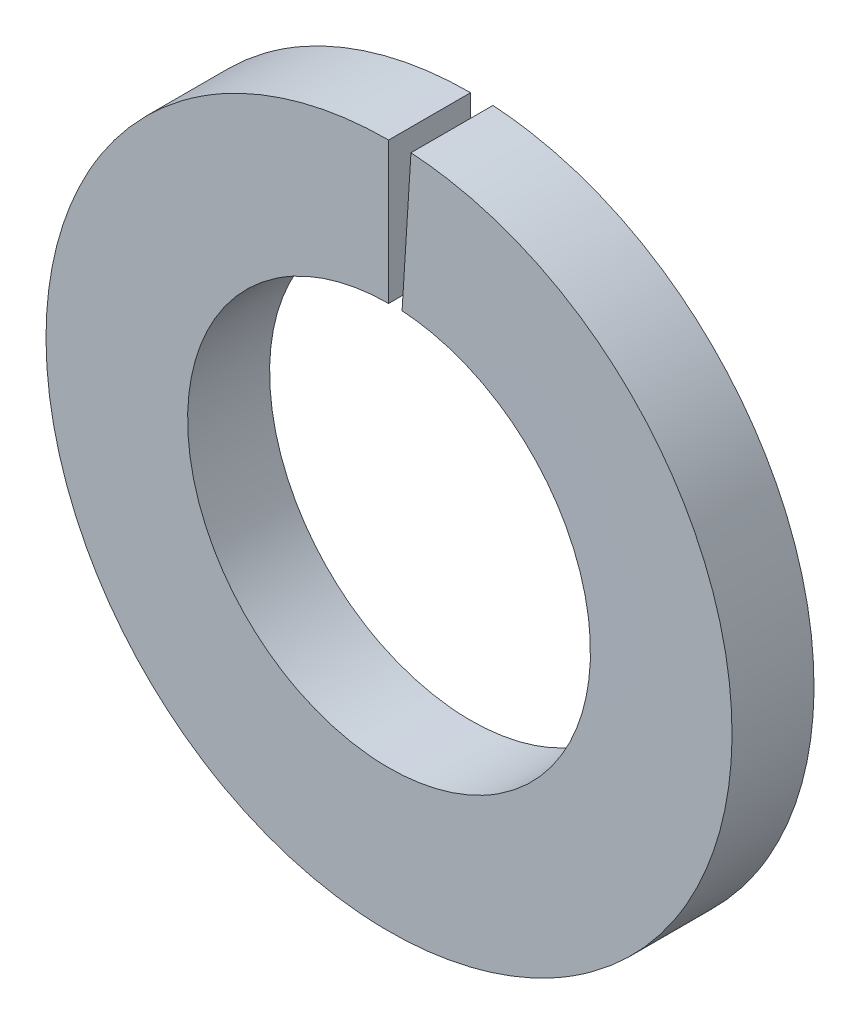
from build123d import *

# Parameters (mm, degrees)
SWEEP1_PITCH       = 0.011111111
SWEEP1_HEIGHT      = 0.011
SWEEP1_RADIUS      = 4.6
SWEEP1_START_ANGLE = 90
SKETCH2_W          = 1.1
SKETCH2_H          = 1.9


with BuildPart() as part:
    # Sweep1: sweep along a helix
    with BuildLine() as sweep1_path:
        add(Helix(SWEEP1_PITCH, SWEEP1_HEIGHT, SWEEP1_RADIUS, center=(0, 0, 0), direction=(0, 0, -1), lefthand=True, mode=Mode.PRIVATE).rotate(Axis((0, 0, 0), (0, 0, -1)), SWEEP1_START_ANGLE))
    # Sketch2 → Sweep1 (sweep)
    with BuildSketch(Plane(origin=(0, 0, 0), x_dir=(0, 0, -1), z_dir=(1, 0, 0))):
        with Locations((-0.55, 3.65)):
            Rectangle(SKETCH2_W, SKETCH2_H)
    sweep(path=sweep1_path.line, is_frenet=True)


solid = part.part
